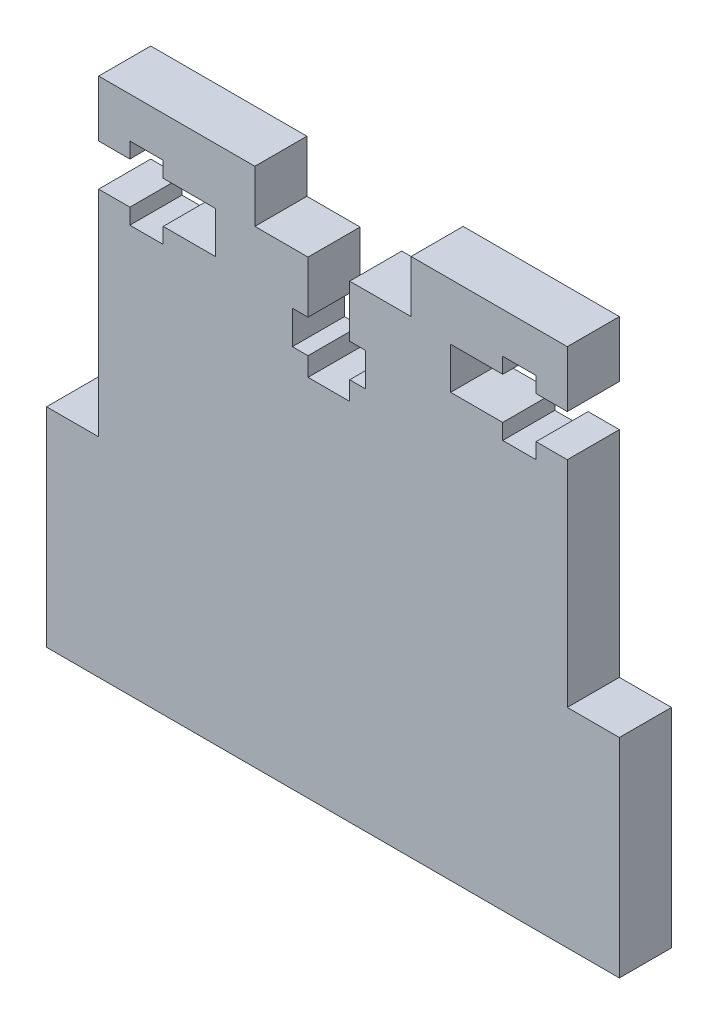
from build123d import *

# Parameters (mm, degrees)
SKETCH1_W           = 45
SKETCH1_H           = 50
BOSS_EXTRUDE1_DEPTH = 5
CUT_EXTRUDE1_DEPTH  = 5
SKETCH6_W           = 5
SKETCH6_H           = 20
BOSS_EXTRUDE2_DEPTH = 5
SKETCH7_W           = 15
SKETCH7_H           = 5
CUT_EXTRUDE2_DEPTH  = 10
CUT_EXTRUDE3_DEPTH  = 5


with BuildPart() as part:
    # Sketch1 → Boss-Extrude1 (new body)
    with BuildSketch(Plane.XY):
        with Locations((-7.5, 0)):
            Rectangle(SKETCH1_W, SKETCH1_H)
    extrude(amount=BOSS_EXTRUDE1_DEPTH)

    # Sketch5 → Cut-Extrude1 (cut)
    with BuildSketch(Plane.XY.offset(5)):
        Polygon((-30, 15.6), (-30, 19.6), (-27, 19.6), (-27, 21.1), (-23.8, 21.1), (-23.8, 19.6), (-18.8, 19.6), (-18.8, 15.6), (-23.8, 15.6), (-23.8, 14.1), (-27, 14.1), (-27, 15.6), align=None)
        Polygon((15, 19.6), (12, 19.6), (12, 21.1), (8.8, 21.1), (8.8, 19.6), (3.8, 19.6), (3.8, 15.6), (8.8, 15.6), (8.8, 14.1), (12, 14.1), (12, 15.6), (15, 15.6), align=None)
    extrude(amount=-CUT_EXTRUDE1_DEPTH, mode=Mode.SUBTRACT)

    # Sketch6 → Boss-Extrude2 (add)
    with BuildSketch(Plane(origin=(0, 0, 0), x_dir=(-1, 0, 0), z_dir=(0, 0, -1))):
        with Locations((-17.5, -15)):
            Rectangle(SKETCH6_W, SKETCH6_H)
        with Locations((32.5, -15)):
            Rectangle(SKETCH6_W, SKETCH6_H)
    extrude(amount=-BOSS_EXTRUDE2_DEPTH)

    # Sketch7 → Cut-Extrude2 (cut)
    with BuildSketch(Plane.XY.offset(5)):
        with Locations((-7.5, 22.5)):
            Rectangle(SKETCH7_W, SKETCH7_H)
    extrude(amount=-CUT_EXTRUDE2_DEPTH, mode=Mode.SUBTRACT)

    # Sketch8 → Cut-Extrude3 (cut)
    with BuildSketch(Plane.XY.offset(5)):
        Polygon((-9.894748858, 20), (-9.894748858, 15), (-11.394748858, 15), (-11.394748858, 11.8), (-9.894748858, 11.8), (-9.894748858, 10), (-5.894748858, 10), (-5.894748858, 11.8), (-4.394748858, 11.8), (-4.394748858, 15), (-5.894748858, 15), (-5.894748858, 20), align=None)
    extrude(amount=-CUT_EXTRUDE3_DEPTH, mode=Mode.SUBTRACT)


solid = part.part
